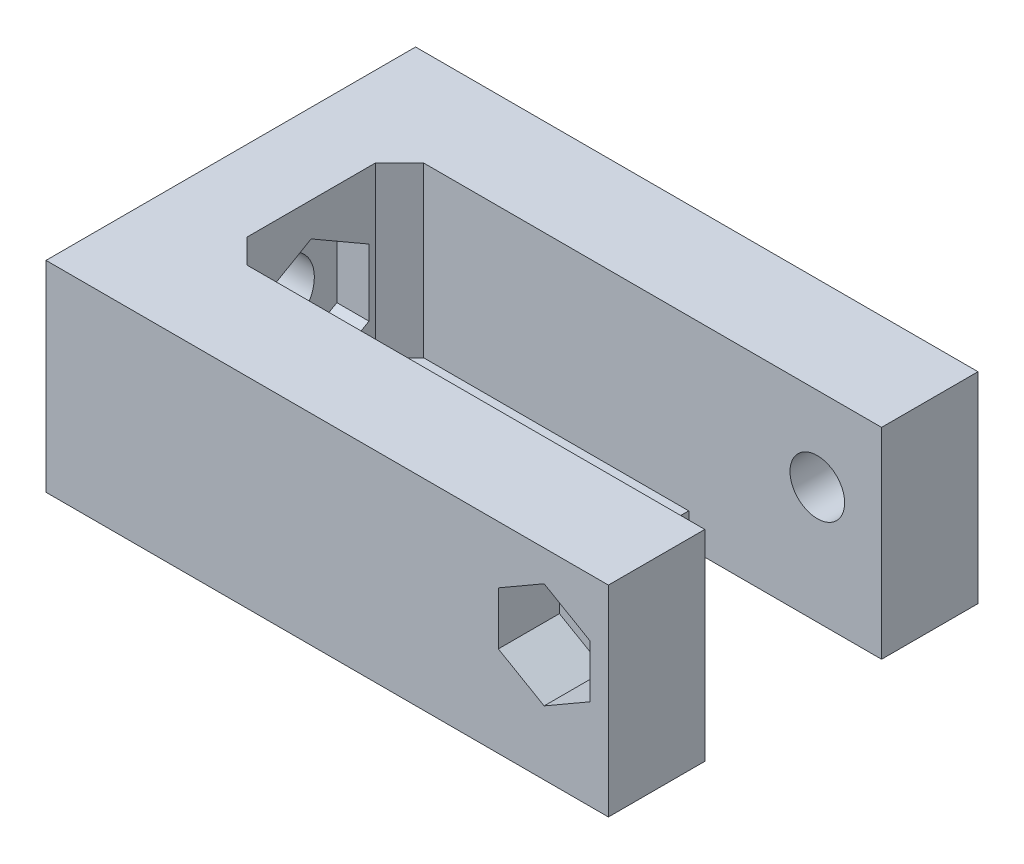
from build123d import *

# Parameters (mm, degrees)
SKETCH1_W               = 23
SKETCH1_H               = 12.5
BOSS_EXTRUDE1_DEPTH     = 35
SKETCH2_W               = 11
SKETCH2_H               = 12.5
CUT_EXTRUDE1_DEPTH      = 30
CUT_EXTRUDE2_DEPTH      = 44.706406853
CUT_EXTRUDE2_DEPTH_BACK = 44.706406853
SKETCH3_R               = 1.7
SKETCH4_R               = 2.2
CUT_EXTRUDE3_DEPTH      = 10
CUT_EXTRUDE4_DEPTH      = 2
SKETCH6_R               = 3.25
CUT_EXTRUDE5_DEPTH      = 2.5
CUT_EXTRUDE6_DEPTH      = 3.8
SKETCH8_W               = 18
SKETCH8_H               = 2
BOSS_EXTRUDE2_DEPTH     = 11
CHAMFER2_SIZE           = 1.5


with BuildPart() as part:
    # Sketch1 → Boss-Extrude1 (new body)
    with BuildSketch(Plane(origin=(0, 0, 0), x_dir=(0, 0, -1), z_dir=(1, 0, 0))):
        with Locations((11.5, 6.25)):
            Rectangle(SKETCH1_W, SKETCH1_H)
    extrude(amount=BOSS_EXTRUDE1_DEPTH)

    # Sketch2 → Cut-Extrude1 (cut)
    with BuildSketch(Plane(origin=(35, 0, 0), x_dir=(0, 0, -1), z_dir=(1, 0, 0))):
        with Locations((11.5, 6.25)):
            Rectangle(SKETCH2_W, SKETCH2_H)
    extrude(amount=-CUT_EXTRUDE1_DEPTH, mode=Mode.SUBTRACT)

    # Sketch3 → Cut-Extrude2 (cut, two sides: drawn at the far end of the back side and taken through both)
    with BuildSketch(Plane(origin=(0, 0, -23), x_dir=(-1, 0, 0), z_dir=(0, 0, -1)).offset(-CUT_EXTRUDE2_DEPTH_BACK)):
        with Locations(Location((-31, 7.28, 0), (0, 0, 90))):
            Circle(SKETCH3_R)
    extrude(amount=CUT_EXTRUDE2_DEPTH + CUT_EXTRUDE2_DEPTH_BACK, mode=Mode.SUBTRACT)

    # Sketch4 → Cut-Extrude3 (cut)
    with BuildSketch(Plane.ZY):
        with Locations((-11.5, 6.25)):
            Circle(SKETCH4_R)
    extrude(amount=-CUT_EXTRUDE3_DEPTH, mode=Mode.SUBTRACT)

    # Sketch5 → Cut-Extrude4 (cut)
    with BuildSketch(Plane(origin=(5, 0, 0), x_dir=(0, 0, -1), z_dir=(1, 0, 0))):
        Polygon((7.9, 8.328460969), (7.9, 4.171539031), (11.5, 2.093078062), (15.1, 4.171539031), (15.1, 8.328460969), (11.5, 10.406921938), align=None)
    extrude(amount=-CUT_EXTRUDE4_DEPTH, mode=Mode.SUBTRACT)

    # Sketch6 → Cut-Extrude5 (cut)
    with BuildSketch(Plane(origin=(0, 0, -23), x_dir=(-1, 0, 0), z_dir=(0, 0, -1))):
        with Locations((-31, 7.28)):
            Circle(SKETCH6_R)
    extrude(amount=-CUT_EXTRUDE5_DEPTH, mode=Mode.SUBTRACT)

    # Sketch7 → Cut-Extrude6 (cut)
    with BuildSketch(Plane.XY):
        Polygon((28.15, 8.925448267), (28.15, 5.634551733), (31, 3.989103466), (33.85, 5.634551733), (33.85, 8.925448267), (31, 10.570896534), align=None)
    extrude(amount=-CUT_EXTRUDE6_DEPTH, mode=Mode.SUBTRACT)

    # Sketch8 → Boss-Extrude2 (add)
    with BuildSketch(Plane(origin=(0, 0, -6), x_dir=(-1, 0, 0), z_dir=(0, 0, -1))):
        with Locations((-14, 1)):
            Rectangle(SKETCH8_W, SKETCH8_H)
    extrude(amount=BOSS_EXTRUDE2_DEPTH)

    # Chamfer2
    chamfer2_edges = [part.edges().sort_by_distance(p)[0] for p in [
        (5, 7.25, -6),
        (5, 7.25, -17),
    ]]
    chamfer(chamfer2_edges, length=CHAMFER2_SIZE)


solid = part.part
